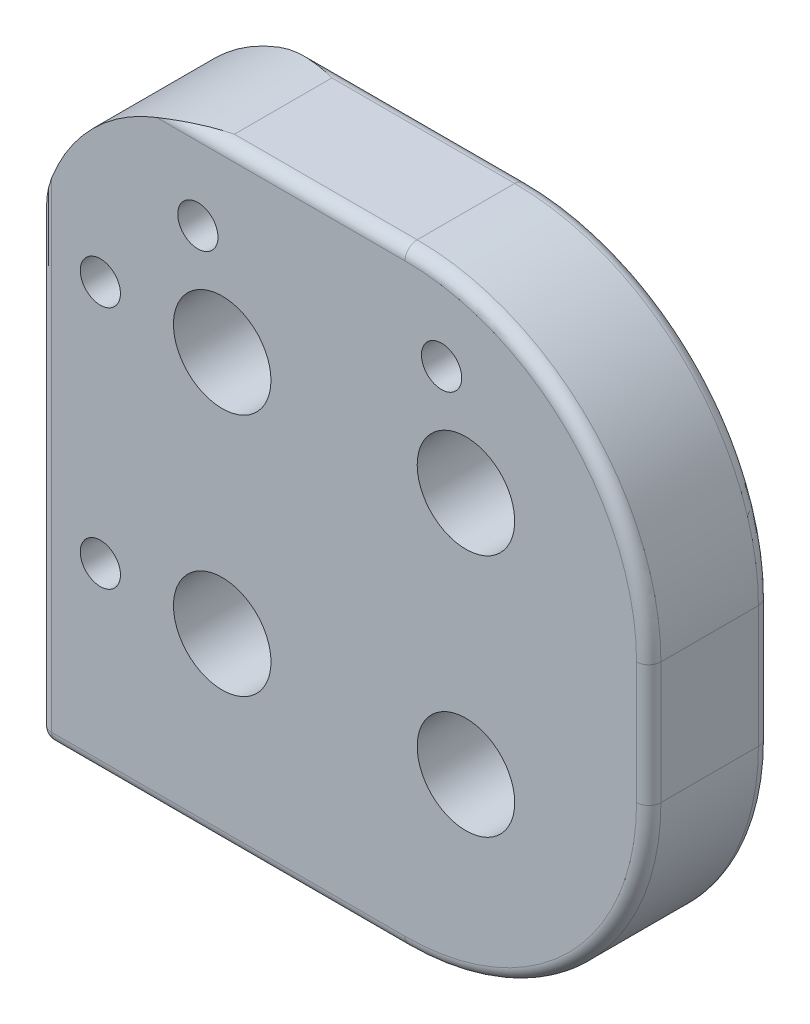
from build123d import *

# Parameters (mm, degrees)
SKETCH_1_W          = 50
SKETCH_1_H          = 50
EXTRUDE_1_DEPTH     = 10
FILLET_1_R          = 20
FILLET_2_R          = 1
SKETCH_3_R          = 4
CUT_EXTRUDE_2_DEPTH = 10
SKETCH_4_R          = 1.65
CUT_EXTRUDE_3_DEPTH = 10
CUT_EXTRUDE_4_DEPTH = 10


with BuildPart() as part:
    # 草图1 → 凸台-拉伸1 (new body)
    with BuildSketch(Plane.XY):
        Rectangle(SKETCH_1_W, SKETCH_1_H)
    extrude(amount=EXTRUDE_1_DEPTH)

    # 圆角1
    fillet_1_edges = [part.edges().sort_by_distance(p)[0] for p in [
        (25, -25, 5),
        (25, 25, 5),
    ]]
    fillet(fillet_1_edges, radius=FILLET_1_R)

    # 圆角2
    fillet_2_edges = [part.edges().sort_by_distance(p)[0] for p in [
        (-25, 0, 10),
        (25, 0, 0),
        (25, 0, 10),
        (-10, -25, 10),
        (-10, 25, 0),
        (19.142135624, 19.142135624, 0),
        (19.142135624, -19.142135624, 0),
        (-10, 25, 10),
        (19.142135624, 19.142135624, 10),
        (19.142135624, -19.142135624, 10),
        (-10, -25, 0),
        (-25, 0, 0),
        (-25, -25, 5),
        (-25, 25, 5),
    ]]
    fillet(fillet_2_edges, radius=FILLET_2_R)

    # 草图3 → 切除-拉伸2 (cut)
    with BuildSketch(Plane.XY.offset(10)):
        with Locations((-10, 10)):
            Circle(SKETCH_3_R)
        with Locations(Location((10, 10, 0), (0, 0, 180))):
            Circle(SKETCH_3_R)
        with Locations((10, -10)):
            Circle(SKETCH_3_R)
        with Locations(Location((-10, -10, 0), (0, 0, 180))):
            Circle(SKETCH_3_R)
    extrude(amount=-CUT_EXTRUDE_2_DEPTH, mode=Mode.SUBTRACT)

    # 草图4 → 切除-拉伸3 (cut)
    with BuildSketch(Plane.XY.offset(10)):
        with Locations((-20, -10)):
            Circle(SKETCH_4_R)
        with Locations((-20, 10)):
            Circle(SKETCH_4_R)
        with Locations((-12, 18)):
            Circle(SKETCH_4_R)
        with Locations((8, 18)):
            Circle(SKETCH_4_R)
    extrude(amount=-CUT_EXTRUDE_3_DEPTH, mode=Mode.SUBTRACT)

    # 草图5 → 切除-拉伸4 (cut)
    with BuildSketch(Plane.XY.offset(10)):
        with BuildLine():
            Line((-25, 10), (-25, 6.241461477))
            Line((-25, 6.241461477), (-27.089820729, 25))
            Line((-27.089820729, 25), (-10, 25))
            ThreePointArc((-10, 25), (-20.606601718, 20.606601718), (-25, 10))
        make_face()
    extrude(amount=-CUT_EXTRUDE_4_DEPTH, mode=Mode.SUBTRACT)


solid = part.part
